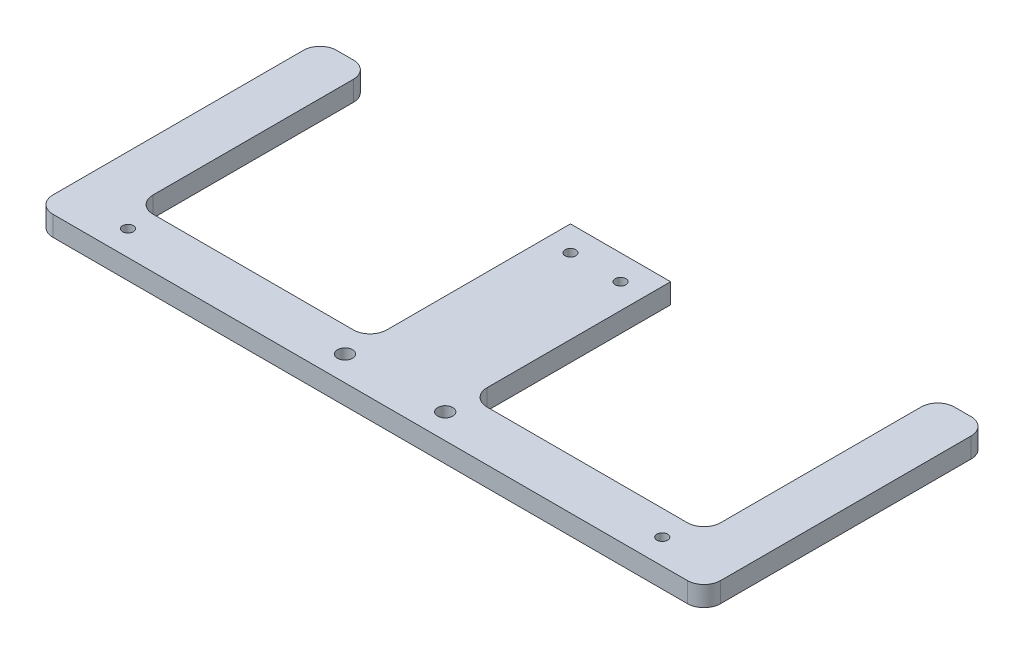
from build123d import *

# Parameters (mm, degrees)
BOSS_EXTRUDE1_DEPTH  = 6
FILLET1_R            = 5
SKETCH2_R            = 2.25
SKETCH2_R_2          = 1.6
CUT_EXTRUDE1_DEPTH   = 123.21292894
FILLET1_OF_MIRROR1_R = 5


with BuildPart() as part:
    # Sketch1 → Boss-Extrude1 (new body)
    with BuildSketch(Plane(origin=(0, 0, 0), x_dir=(1, 0, 0), z_dir=(0, 1, 0))):
        Polygon((-85, 0), (-85, 70), (-100, 70), (-100, -15), (0, -15), (0, 0), (0, 60), (-15, 60), (-15, 0), align=None)
    boss_extrude1 = extrude(amount=BOSS_EXTRUDE1_DEPTH)

    # Fillet1
    fillet1_edges = [part.edges().sort_by_distance(p)[0] for p in [
        (-100, 3, 15),
        (-100, 3, -70),
        (-85, 3, -70),
        (-85, 3, 0),
        (-15, 3, 0),
    ]]
    fillet(fillet1_edges, radius=FILLET1_R)

    # Sketch2 → Cut-Extrude1 (cut, through all)
    with BuildSketch(Plane(origin=(0, 6, 0), x_dir=(1, 0, 0), z_dir=(0, 1, 0))):
        with Locations(Location((-15, -7.5, 0), (0, 0, 270))):
            Circle(SKETCH2_R)
        with Locations(Location((-80, -7.5, 0), (0, 0, 270))):
            Circle(SKETCH2_R_2)
        with Locations(Location((-7.5, 52.5, 0), (0, 0, 270))):
            Circle(SKETCH2_R_2)
    cut_extrude1 = extrude(amount=-CUT_EXTRUDE1_DEPTH, mode=Mode.SUBTRACT)

    # Mirror1: Boss-Extrude1, Cut-Extrude1 across plane
    add(boss_extrude1.mirror(Plane(origin=(0, 0, 0), x_dir=(0, 0, 1), z_dir=(1, 0, 0))))
    add(cut_extrude1.mirror(Plane(origin=(0, 0, 0), x_dir=(0, 0, 1), z_dir=(1, 0, 0))), mode=Mode.SUBTRACT)

    # Fillet1 of Mirror1
    fillet1_of_mirror1_edges = [part.edges().sort_by_distance(p)[0] for p in [
        (100, 3, 15),
        (100, 3, -70),
        (85, 3, -70),
        (85, 3, 0),
        (15, 3, 0),
    ]]
    fillet(fillet1_of_mirror1_edges, radius=FILLET1_OF_MIRROR1_R)


solid = part.part
